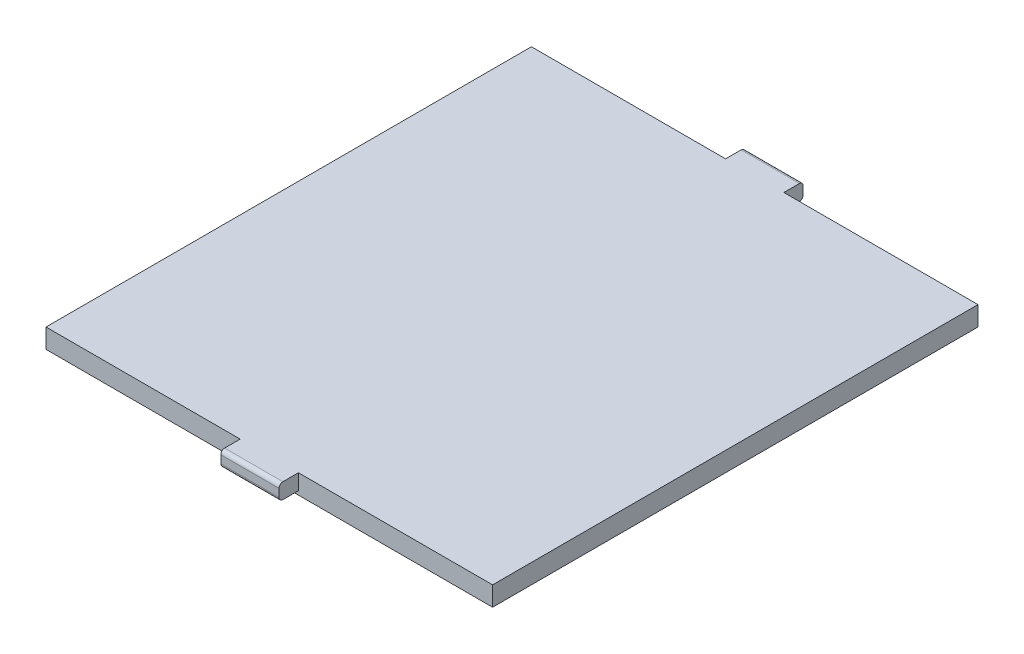
from build123d import *

# Parameters (mm, degrees)
SKETCH1_W           = 584.2
SKETCH1_H           = 635
BOSS_EXTRUDE1_DEPTH = 25.4
SKETCH2_W           = 76.2
SKETCH2_H           = 20.32
BOSS_EXTRUDE2_DEPTH = 25.4
SKETCH3_W           = 76.2
SKETCH3_H           = 20.32
BOSS_EXTRUDE3_DEPTH = 25.4
FILLET1_R           = 5.08
FILLET2_R           = 5.08
FILLET3_R           = 5.08
FILLET4_R           = 5.08


with BuildPart() as part:
    # Sketch1 → Boss-Extrude1 (new body)
    with BuildSketch(Plane(origin=(0, 0, 0), x_dir=(1, 0, 0), z_dir=(0, 1, 0))):
        with Locations((292.1, 317.5)):
            Rectangle(SKETCH1_W, SKETCH1_H)
    extrude(amount=BOSS_EXTRUDE1_DEPTH)

    # Sketch2 → Boss-Extrude2 (add)
    with BuildSketch(Plane.XY):
        with Locations((292.1, 15.24)):
            Rectangle(SKETCH2_W, SKETCH2_H)
    extrude(amount=BOSS_EXTRUDE2_DEPTH)

    # Sketch3 → Boss-Extrude3 (add)
    with BuildSketch(Plane(origin=(0, 0, -635), x_dir=(-1, 0, 0), z_dir=(0, 0, -1))):
        with Locations((-292.1, 15.24)):
            Rectangle(SKETCH3_W, SKETCH3_H)
    extrude(amount=BOSS_EXTRUDE3_DEPTH)

    # Fillet1
    fillet1_edges = [part.edges().sort_by_distance(p)[0] for p in [
        (292.1, 25.4, -660.4),
    ]]
    fillet(fillet1_edges, radius=FILLET1_R)

    # Fillet2
    fillet2_edges = [part.edges().sort_by_distance(p)[0] for p in [
        (292.1, 5.08, -660.4),
    ]]
    fillet(fillet2_edges, radius=FILLET2_R)

    # Fillet3
    fillet3_edges = [part.edges().sort_by_distance(p)[0] for p in [
        (292.1, 5.08, 25.4),
    ]]
    fillet(fillet3_edges, radius=FILLET3_R)

    # Fillet4
    fillet4_edges = [part.edges().sort_by_distance(p)[0] for p in [
        (292.1, 25.4, 25.4),
    ]]
    fillet(fillet4_edges, radius=FILLET4_R)


solid = part.part
